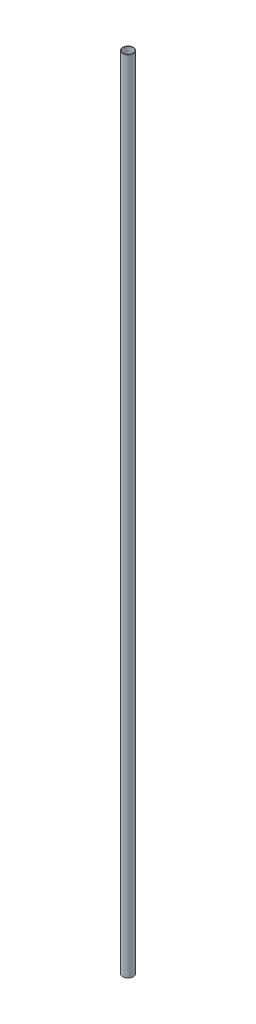
from build123d import *

# Parameters (mm, degrees)
SKETCH2_R           = 6.858
SKETCH2_R_2         = 6.35
BOSS_EXTRUDE1_DEPTH = 1016


with BuildPart() as part:
    # Sketch2 → Boss-Extrude1 (new body)
    with BuildSketch(Plane(origin=(0, 0, 0), x_dir=(1, 0, 0), z_dir=(0, 1, 0))):
        with Locations(Location((0, 0, 0), (0, 0, 270))):
            Circle(SKETCH2_R)
        with Locations(Location((0, 0, 0), (0, 0, 270))):
            Circle(SKETCH2_R_2, mode=Mode.SUBTRACT)
    extrude(amount=BOSS_EXTRUDE1_DEPTH)


solid = part.part
